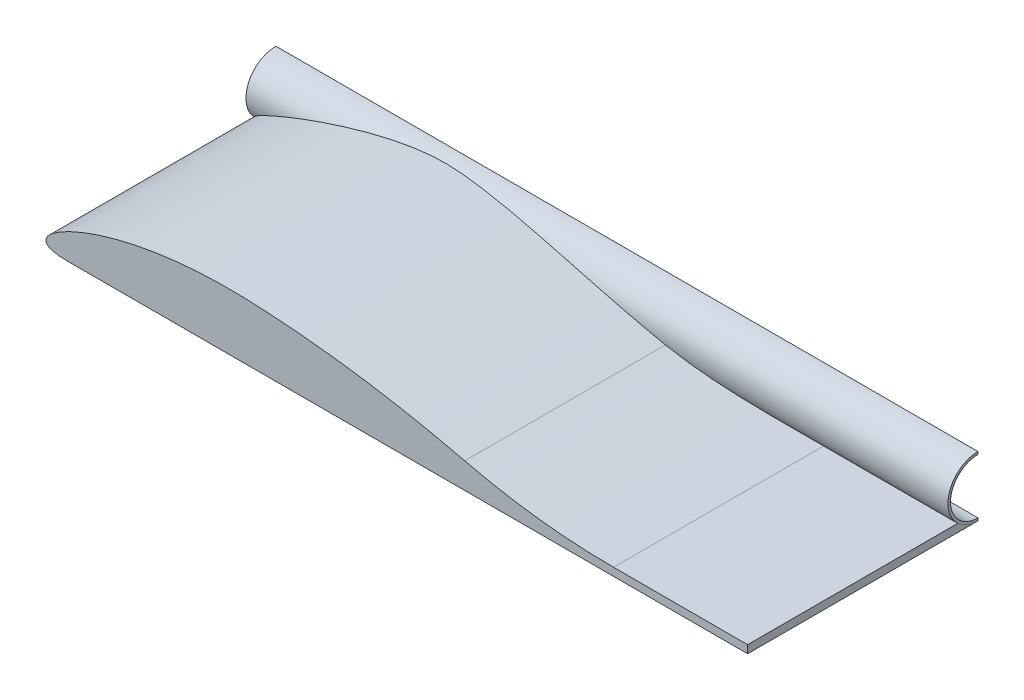
from build123d import *

# Parameters (mm, degrees)
BOSS_EXTRUDE1_DEPTH = 185.42
FILLET1_R           = 508
BOSS_EXTRUDE2_START = -565.049562
BOSS_EXTRUDE2_DEPTH = 565.049574
CUT_EXTRUDE1_DEPTH  = 597.370306171


with BuildPart() as part:
    # Sketch1 → Boss-Extrude1 (new body)
    with BuildSketch(Plane.XY):
        with BuildLine():
            add(Edge.make_bspline(
                [(16.824486281, -3.584005936), (17.576425683, -3.584005936), (21.595703212, -3.543351385), (29.450687295, -3.173180462), (40.913314732, -2.231022297), (53.954734382, -0.933620653), (68.441844322, 0.603641829), (84.220077594, 2.261793956), (101.146412331, 3.900017255), (119.057408579, 5.371009548), (137.798850975, 6.573531856), (157.307672246, 7.348038209), (177.40159034, 7.753534803), (197.867291711, 8.106295079), (218.383935911, 8.253829905), (238.720913993, 8.211809333), (258.659276833, 7.955812655), (277.981187946, 7.500857289), (296.474222895, 6.863195832), (313.932531106, 6.083996751), (330.158311416, 5.198742586), (344.958833395, 4.265782532), (358.177232856, 3.324634453), (369.605973843, 2.442150407), (379.256357552, 1.633649638), (386.613193972, 1.003388636), (392.568540151, 0.420302648), (395.032189851, 0.27723258), (397.393838715, -0.038645243), (397.402740734, 0)],
                knots=[0.53121993, 0.53121993, 0.53121993, 0.53121993, 0.533991629, 0.546033957, 0.560220284, 0.576403357, 0.594370816, 0.613951104, 0.634916885, 0.657088503, 0.68022991, 0.704175481, 0.729090367, 0.754353776, 0.779667752, 0.80476012, 0.829359339, 0.85320871, 0.876041363, 0.897604065, 0.917662212, 0.93596986, 0.952309788, 0.966502759, 0.978350083, 0.987731492, 0.99451092, 0.998633933, 1, 1, 1, 1], degree=3))
            Line((16.824486281, -3.584005936), (563.88, -3.584005936))
            Line((563.88, -3.584005936), (563.88, 2.765994064))
            Line((563.88, 2.765994064), (388.527876564, 2.765994064))
            add(Edge.make_bspline(
                [(397.402740734, 0), (397.411698055, 0.03888532), (395.109063505, 0.667730493), (392.937979901, 1.437651493), (390.154580013, 2.277233064), (388.527876564, 2.765994064)],
                knots=[0, 0, 0, 0, 0.001374553, 0.005484497, 0.011464236, 0.011464236, 0.011464236, 0.011464236], degree=3))
        make_face()
        with BuildLine():
            add(Edge.make_bspline(
                [(397.402740734, 0), (397.411698055, 0.03888532), (395.109063505, 0.667730493), (392.784748718, 1.491991135), (387.04171407, 3.207972013), (379.954865, 5.356589699), (370.615780699, 8.058979559), (359.507412748, 11.143106331), (346.598869358, 14.543871375), (332.06110309, 18.128841799), (316.03889288, 21.806415505), (298.691944358, 25.449886624), (280.209065946, 28.958844329), (260.784413322, 32.227025229), (240.627196049, 35.159834098), (219.959471219, 37.677818053), (199.011497338, 39.711885338), (178.012037109, 41.180494444), (157.089436588, 42.139263372), (136.464680267, 42.213174939), (116.414649467, 41.217940478), (97.304330976, 39.298487784), (79.379986619, 36.549521344), (62.868119065, 33.114783487), (47.965554294, 29.173907116), (34.85097922, 24.899512861), (23.659260509, 20.503409457), (14.515298076, 16.132494214), (7.448223951, 12.010497642), (2.547126277, 8.168994228), (-0.453384309, 4.792791742), (-1.169561594, 1.105575296), (1.414868301, -1.604103887), (5.700982636, -2.840772697), (11.755524499, -3.574452069), (19.698764161, -3.632745796), (29.450687295, -3.173180462), (40.913314732, -2.231022297), (53.954734382, -0.933620653), (68.441844322, 0.603641829), (84.220077594, 2.261793956), (101.146412331, 3.900017255), (119.057408579, 5.371009548), (137.798850975, 6.573531856), (157.307672246, 7.348038209), (177.40159034, 7.753534803), (197.867291711, 8.106295079), (218.383935911, 8.253829905), (238.720913993, 8.211809333), (258.659276833, 7.955812655), (277.981187946, 7.500857289), (296.474222895, 6.863195832), (313.932531106, 6.083996751), (330.158311416, 5.198742586), (344.958833395, 4.265782532), (358.177232856, 3.324634453), (369.605973843, 2.442150407), (379.256357552, 1.633649638), (386.613193972, 1.003388636), (392.568540151, 0.420302648), (395.032189851, 0.27723258), (397.393838715, -0.038645243), (397.402740734, 0)],
                knots=[0, 0, 0, 0, 0.001374553, 0.005484497, 0.012273361, 0.021682196, 0.033580612, 0.047830743, 0.064305953, 0.082777332, 0.103063756, 0.124929017, 0.148149111, 0.172444695, 0.197572106, 0.223268881, 0.249227775, 0.275186209, 0.300900709, 0.326462938, 0.351222485, 0.374905859, 0.397269706, 0.418072414, 0.437079533, 0.454093094, 0.468919632, 0.481391712, 0.491447127, 0.499023571, 0.504293734, 0.507921918, 0.511539686, 0.516780528, 0.52421649, 0.533991629, 0.546033957, 0.560220284, 0.576403357, 0.594370816, 0.613951104, 0.634916885, 0.657088503, 0.68022991, 0.704175481, 0.729090367, 0.754353776, 0.779667752, 0.80476012, 0.829359339, 0.85320871, 0.876041363, 0.897604065, 0.917662212, 0.93596986, 0.952309788, 0.966502759, 0.978350083, 0.987731492, 0.99451092, 0.998633933, 1, 1, 1, 1], degree=3))
        make_face()
    extrude(amount=BOSS_EXTRUDE1_DEPTH)

    # Fillet1
    fillet1_edges = [part.edges().sort_by_distance(p)[0] for p in [
        (388.527876564, 2.765994064, 92.71),
    ]]
    fillet(fillet1_edges, radius=FILLET1_R)

    # Sketch2 → Boss-Extrude2 (add)
    with BuildSketch(Plane(origin=(563.88, 0, 0), x_dir=(0, 0, -1), z_dir=(1, 0, 0)).offset(BOSS_EXTRUDE2_START)):
        with BuildLine():
            ThreePointArc((-16.313445375, 2.765994064), (-8.752870958, -1.940538573), (0, -3.584005936))
            Line((0, -3.584005936), (0, 2.765994064))
            Line((0, 2.765994064), (-16.313445375, 2.765994064))
        make_face()
        with BuildLine():
            Line((-16.313445375, 2.765994064), (0, 2.765994064))
            Line((0, 2.765994064), (0, 44.675994064))
            ThreePointArc((0, 44.675994064), (-22.486532636, 29.298865021), (-16.313445375, 2.765994064))
        make_face()
    extrude(amount=BOSS_EXTRUDE2_DEPTH)

    # Sketch3 → Cut-Extrude1 (cut, through all)
    with BuildSketch(Plane(origin=(563.880012, 0, 0), x_dir=(0, 0, -1), z_dir=(1, 0, 0))):
        with BuildLine():
            Line((0, -1.552005936), (0, 42.643994064))
            ThreePointArc((0, 42.643994064), (-22.098, 20.545994064), (0, -1.552005936))
        make_face()
    extrude(amount=-CUT_EXTRUDE1_DEPTH, mode=Mode.SUBTRACT)


solid = part.part
